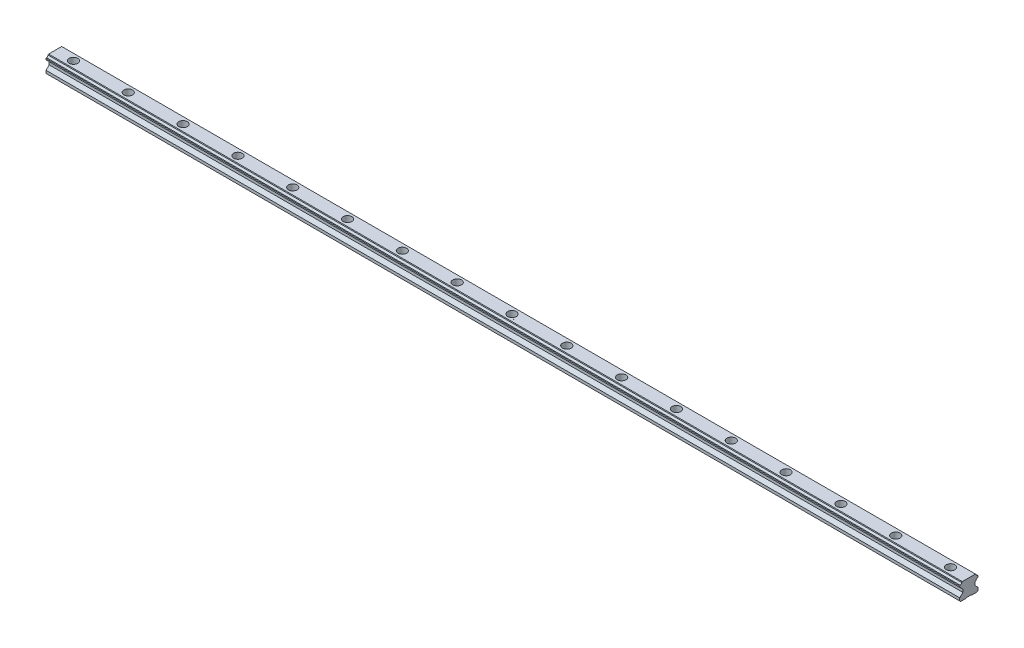
from build123d import *

# Parameters (mm, degrees)
BOSS_EXTRUDE16_DEPTH           = 1000
CBORE_FOR_M3_SHCS1_D           = 6
CBORE_FOR_M3_SHCS1_CBORE_D     = 9.5
CBORE_FOR_M3_SHCS1_CBORE_DEPTH = 8.5
LPATTERN1_COUNT                = 17
LPATTERN1_PITCH                = 60


with BuildPart() as part:
    # Sketch23 → Boss-Extrude16 (new body)
    with BuildSketch(Plane.ZY.offset(-70.000945091)):
        with BuildLine():
            Line((-49.000698983, 19.549927993), (-55.00042051, 19.549574928))
            Line((-55.00042051, 19.549574928), (-56.000487759, 20.549639818))
            Line((-56.000487759, 20.549639818), (-56.000570297, 23.549626764))
            Line((-56.000570297, 23.549626764), (-54.300749779, 25.249885559))
            Line((-54.300749779, 25.249885559), (-52.550749779, 26.999885559))
            Line((-52.550749779, 26.999885559), (-52.550749779, 29.9298172))
            Line((-52.550749779, 29.9298172), (-53.766649723, 31.145683289))
            ThreePointArc((-53.766649723, 31.145683289), (-54.345460672, 32.285243093), (-55.485020638, 32.864053726))
            Line((-55.485020638, 32.864053726), (-56.000945091, 33.379768372))
            Line((-56.000945091, 33.379768372), (-56.000945091, 34.709846497))
            Line((-56.000945091, 34.709846497), (-55.473011971, 35.236911774))
            ThreePointArc((-55.473011971, 35.236911774), (-54.345303642, 35.813840972), (-53.768374443, 36.941549301))
            Line((-53.768374443, 36.941549301), (-53.160857201, 37.549934387))
            Line((-53.160857201, 37.549934387), (-38.840519428, 37.549545288))
            Line((-38.840519428, 37.549545288), (-38.232676506, 36.941701889))
            ThreePointArc((-38.232676506, 36.941701889), (-37.655754627, 35.814040922), (-36.528093338, 35.237119675))
            Line((-36.528093338, 35.237119675), (-36.000945091, 34.709846497))
            Line((-36.000945091, 34.709846497), (-36.000945091, 33.379768372))
            Line((-36.000945091, 33.379768372), (-36.516084671, 32.863981247))
            ThreePointArc((-36.516084671, 32.863981247), (-37.65565644, 32.285168434), (-38.234468937, 31.145596504))
            Line((-38.234468937, 31.145596504), (-39.450896263, 29.9298172))
            Line((-39.450896263, 29.9298172), (-39.450896263, 26.999885559))
            Line((-39.450896263, 26.999885559), (-37.700857082, 25.249885559))
            Line((-37.700857082, 25.249885559), (-36.000624657, 23.5496912))
            Line((-36.000624657, 23.5496912), (-36.000478222, 20.549543738))
            Line((-36.000478222, 20.549543738), (-37.000943124, 19.549933895))
            Line((-37.000943124, 19.549933895), (-43.000943124, 19.549930944))
            Line((-43.000943124, 19.549930944), (-43.50094337, 20.049930698))
            Line((-43.50094337, 20.049930698), (-48.50094337, 20.049928238))
            Line((-48.50094337, 20.049928238), (-49.000698983, 19.549927993))
        make_face()
    extrude(amount=-BOSS_EXTRUDE16_DEPTH)

    # CBORE for M3 SHCS1 (through all)
    with Locations(Plane(origin=(0, 37.548489921, 0.001020233), x_dir=(-1, 0, 0), z_dir=(0, 0.9999999996308662, 2.717108542433418e-05))):
        with Locations((-90, -46.002269662)):
            cbore_for_m3_shcs1 = CounterBoreHole(CBORE_FOR_M3_SHCS1_D / 2, CBORE_FOR_M3_SHCS1_CBORE_D / 2, CBORE_FOR_M3_SHCS1_CBORE_DEPTH)

    # LPattern1: CBORE for M3 SHCS1 ×17
    with Locations(*[(i * LPATTERN1_PITCH, 0, 0) for i in range(1, LPATTERN1_COUNT)]):
        add(cbore_for_m3_shcs1, mode=Mode.SUBTRACT)


solid = part.part
